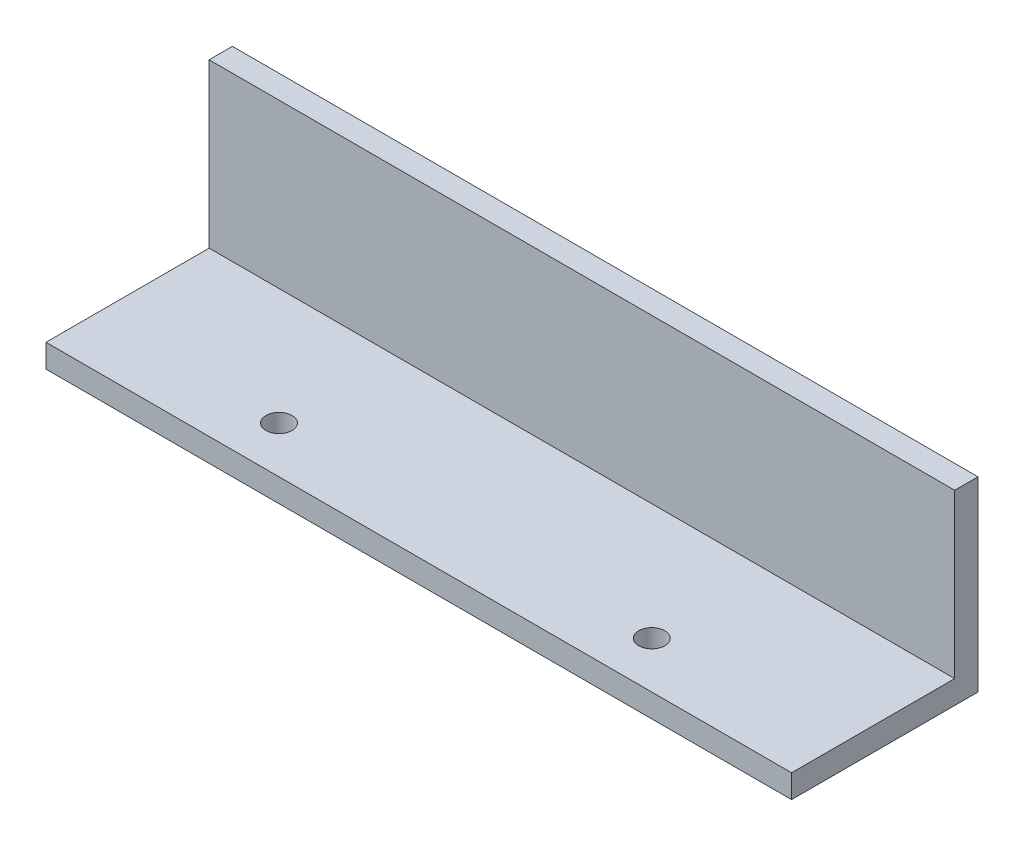
from build123d import *

# Parameters (mm, degrees)
SKETCH1_W           = 101.6
SKETCH1_H           = 50.8
BOSS_EXTRUDE1_DEPTH = 3.175
SKETCH3_W           = 101.6
SKETCH3_H           = 3.175
BOSS_EXTRUDE2_DEPTH = 22.225
SKETCH4_R           = 1.778
CUT_EXTRUDE1_DEPTH  = 117.397422652
SKETCH4_3_R         = 1.778
CUT_EXTRUDE2_DEPTH  = 22.225
SKETCH7_W           = 101.6
SKETCH7_H           = 3.175
CUT_EXTRUDE3_DEPTH  = 25.4


with BuildPart() as part:
    # Sketch1 → Boss-Extrude1 (new body)
    with BuildSketch(Plane(origin=(0, 0, 0), x_dir=(1, 0, 0), z_dir=(0, 1, 0))):
        with Locations((50.8, 25.4)):
            Rectangle(SKETCH1_W, SKETCH1_H)
    extrude(amount=BOSS_EXTRUDE1_DEPTH)

    # Sketch3 → Boss-Extrude2 (add)
    with BuildSketch(Plane(origin=(0, 3.175, 0), x_dir=(1, 0, 0), z_dir=(0, 1, 0))):
        with Locations((50.8, 49.2125)):
            Rectangle(SKETCH3_W, SKETCH3_H)
    extrude(amount=BOSS_EXTRUDE2_DEPTH)

    # Sketch4 → Cut-Extrude1 (cut, through all)
    with BuildSketch(Plane(origin=(0, 0, 0), x_dir=(-1, 0, 0), z_dir=(0, -1, 0))):
        with Locations((-25.4, 31.75)):
            Circle(SKETCH4_R)
    extrude(amount=-CUT_EXTRUDE1_DEPTH, mode=Mode.SUBTRACT)

    # Sketch4<3> → Cut-Extrude2 (cut)
    with BuildSketch(Plane(origin=(0, 0, 0), x_dir=(-1, 0, 0), z_dir=(0, -1, 0))):
        with Locations((-25.4, 31.75)):
            Circle(SKETCH4_3_R)
        with Locations((-76.2, 31.75)):
            Circle(SKETCH4_3_R)
    extrude(amount=-CUT_EXTRUDE2_DEPTH, mode=Mode.SUBTRACT)

    # Sketch7 → Cut-Extrude3 (cut)
    with BuildSketch(Plane.XY):
        with Locations((50.8, 1.5875)):
            Rectangle(SKETCH7_W, SKETCH7_H)
    extrude(amount=-CUT_EXTRUDE3_DEPTH, mode=Mode.SUBTRACT)


solid = part.part
